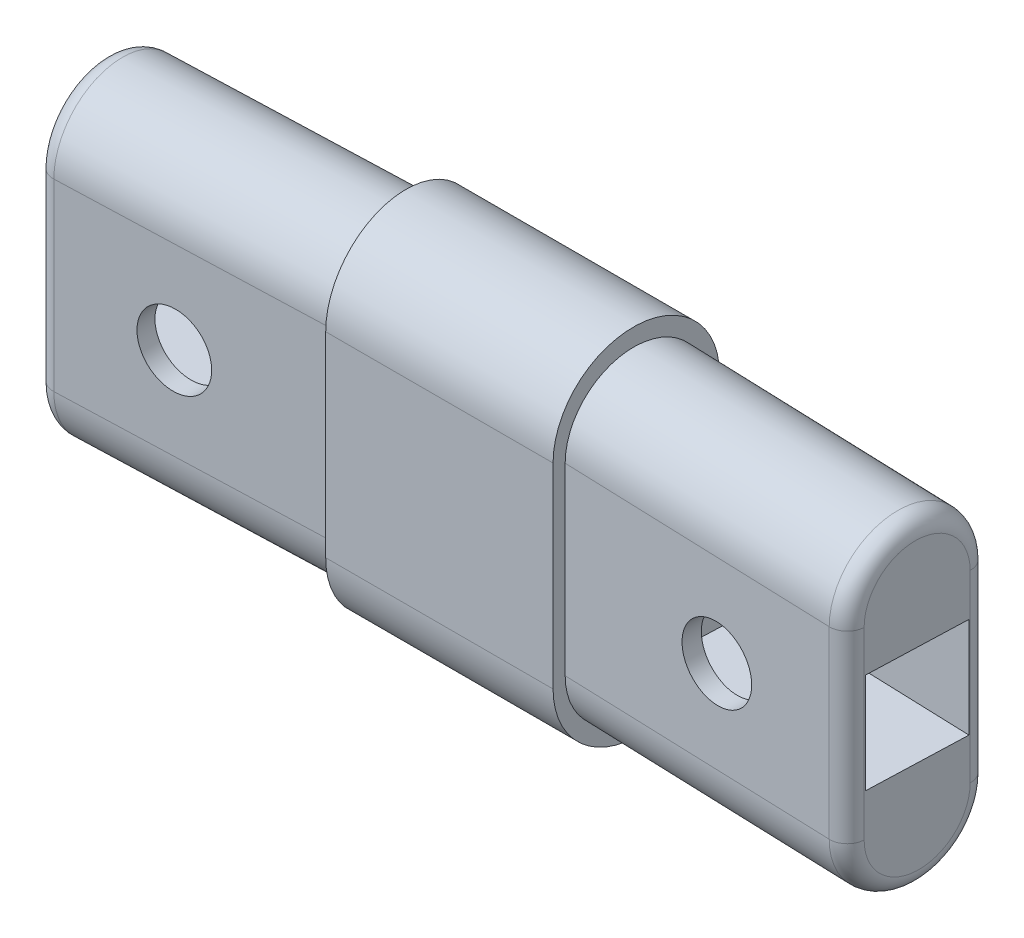
from build123d import *

# Parameters (mm, degrees)
CENTER_DEPTH         = 12
CENTER_DEPTH_BACK    = 12
ANGLE_CUT_DEPTH      = 21.632498637
ANGLE_CUT_DEPTH_BACK = 21.632498637
END_DEPTH            = 25
FILLET2_R            = 1.5
SKETCH10_W           = 8.6
SKETCH10_H           = 8.6
SQUARE_HOLE_DEPTH    = 18.6
ROUND_HOLE_REACH     = 42.465
SKETCH11_R           = 3.1
FILLET2_OF_MIRROR2_R = 1.5


with BuildPart() as part:
    # Sketch1 → Center (new, two sides: drawn at the far end of the back side and taken through both)
    with BuildSketch(Plane.ZY.offset(-CENTER_DEPTH_BACK)):
        with BuildLine():
            Line((6.9, 8.4), (6.9, -8.4))
            ThreePointArc((6.9, -8.4), (0, -15.3), (-6.9, -8.4))
            Line((-6.9, -8.4), (-6.9, 8.4))
            ThreePointArc((-6.9, 8.4), (0, 15.3), (6.9, 8.4))
        make_face()
    extrude(amount=CENTER_DEPTH + CENTER_DEPTH_BACK)

    # Sketch8 → Angle Cut (cut, two sides: drawn at the far end of the back side and taken through both)
    with BuildSketch(Plane(origin=(0, 0, 0), x_dir=(1, 0, 0), z_dir=(0, 1, 0)).offset(-ANGLE_CUT_DEPTH_BACK)):
        Polygon((-20.349207695, 10), (-10.349207695, 10), (-9.650792305, -10), (-20.349207695, -10), align=None)
        Polygon((20.349207695, -10), (9.650792305, -10), (10.349207695, 10), (20.349207695, 10), align=None)
    extrude(amount=ANGLE_CUT_DEPTH + ANGLE_CUT_DEPTH_BACK, mode=Mode.SUBTRACT)

    # Sketch9 → End (add)
    with BuildSketch(Plane(origin=(9.987820251, 0, 0.348782369), x_dir=(0.03489949670249425, 0, -0.999390827019096), z_dir=(0.999390827019096, 0, 0.03489949670249425))):
        with BuildLine():
            Line((-5.551005033, -7.9), (-5.551005033, 7.9))
            ThreePointArc((-5.551005033, 7.9), (0.348994967, 13.8), (6.248994967, 7.9))
            Line((6.248994967, 7.9), (6.248994967, -7.9))
            ThreePointArc((6.248994967, -7.9), (0.348994967, -13.8), (-5.551005033, -7.9))
        make_face()
    end = extrude(amount=END_DEPTH)

    # Fillet2
    fillet2_edges = [part.edges().sort_by_distance(p)[0] for p in [
        (34.778863645, 0, 6.768893297),
        (34.984770675, 13.8, 0.872487418),
        (35.190677706, 0, -5.023918462),
        (34.984770675, -13.8, 0.872487418),
    ]]
    fillet(fillet2_edges, radius=FILLET2_R)

    # Sketch10 → Square Hole (cut)
    with BuildSketch(Plane(origin=(34.972590927, 0, 1.221269786), x_dir=(0.03489949670249425, 0, -0.999390827019096), z_dir=(0.999390827019096, 0, 0.03489949670249425))):
        with Locations((0.348994967, 0)):
            Rectangle(SKETCH10_W, SKETCH10_H)
    square_hole = extrude(amount=-SQUARE_HOLE_DEPTH, mode=Mode.SUBTRACT)

    # Sketch11 → Round Hole (cut, up to next)
    with BuildSketch(Plane(origin=(-0.193727282, 0, 5.547623511), x_dir=(0.999390827019096, 0, 0.03489949670249425), z_dir=(-0.03489949670249425, 0, 0.999390827019096)), mode=Mode.PRIVATE) as round_hole_sk1:
        with Locations((23.49390827, 0)):
            Circle(SKETCH11_R)
    round_hole_tool1 = extrude(round_hole_sk1.sketch, amount=-ROUND_HOLE_REACH, mode=Mode.PRIVATE) & part.part
    round_hole = round_hole_tool1.solids().sort_by_distance((23.285869, 0, 6.367549))[0]
    add(round_hole, mode=Mode.SUBTRACT)

    # Mirror2: End, Square Hole, Round Hole across plane
    add(end.mirror(Plane(origin=(0, 0, 0), x_dir=(0, 0, 1), z_dir=(1, 0, 0))))
    add(square_hole.mirror(Plane(origin=(0, 0, 0), x_dir=(0, 0, 1), z_dir=(1, 0, 0))), mode=Mode.SUBTRACT)
    add(round_hole.mirror(Plane(origin=(0, 0, 0), x_dir=(0, 0, 1), z_dir=(1, 0, 0))), mode=Mode.SUBTRACT)

    # Fillet2 of Mirror2
    fillet2_of_mirror2_edges = [part.edges().sort_by_distance(p)[0] for p in [
        (-34.778863645, 0, 6.768893297),
        (-34.984770675, 13.8, 0.872487418),
        (-35.190677706, 0, -5.023918462),
        (-34.984770675, -13.8, 0.872487418),
    ]]
    fillet(fillet2_of_mirror2_edges, radius=FILLET2_OF_MIRROR2_R)


solid = part.part
